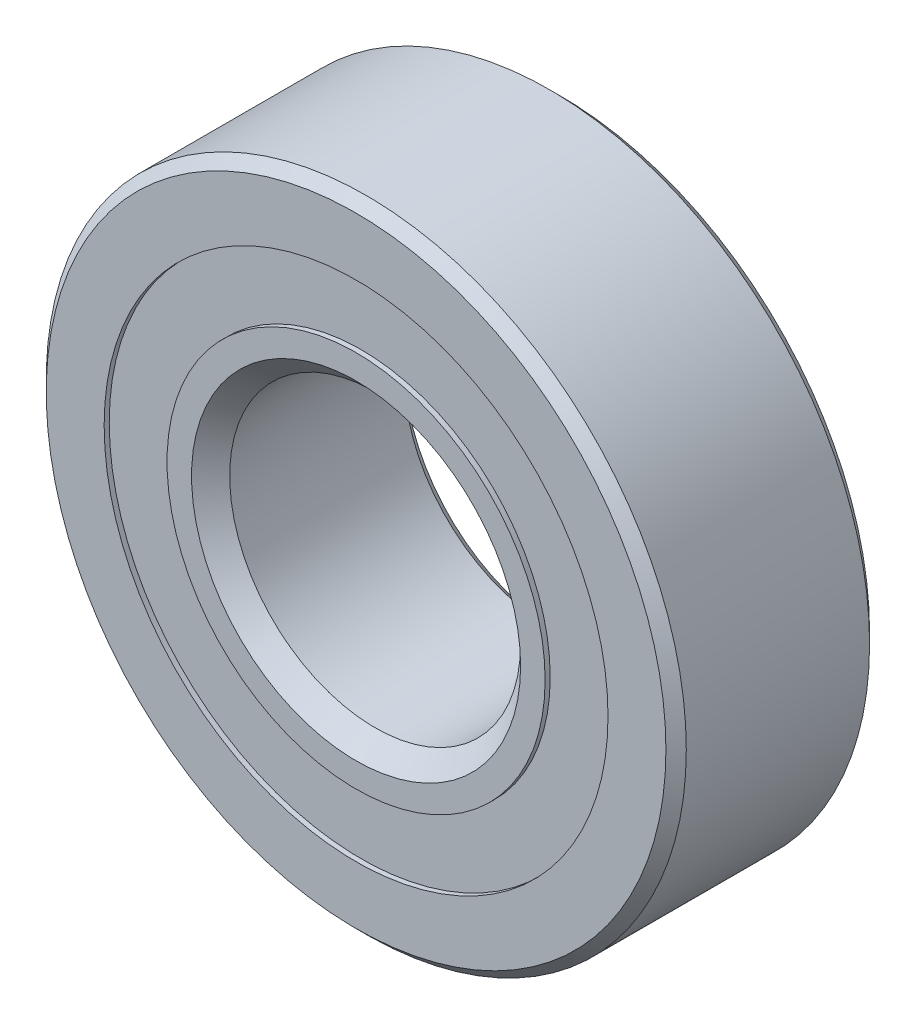
from build123d import *

# Parameters (mm, degrees)
CIRPATTERN1_COUNT = 12
SKETCH5_W         = 2.596321981
SKETCH5_H         = 3.431208825


with BuildPart() as part:
    # Sketch1 → Revolve1 (revolve)
    with BuildSketch(Plane(origin=(0, 0, 0), x_dir=(0, 0, -1), z_dir=(1, 0, 0))):
        with BuildLine():
            Line((5.000625, 17.4625), (-5.000625, 17.4625))
            Line((-5.000625, 17.4625), (-5.55625, 16.906875))
            Line((-5.55625, 16.906875), (-5.55625, 13.746703297))
            Line((-5.55625, 13.746703297), (-2.469444444, 13.746703297))
            ThreePointArc((-2.469444444, 13.746703297), (0, 15.382115519), (2.469444444, 13.746703297))
            Line((2.469444444, 13.746703297), (5.55625, 13.746703297))
            Line((5.55625, 13.746703297), (5.55625, 16.906875))
            Line((5.55625, 16.906875), (5.000625, 17.4625))
        make_face()
    revolve(axis=Axis((0, 0, 5.55625), (0, 0, -1)))


with BuildPart() as body_2:
    # Sketch3 → Revolve3 (revolve)
    with BuildSketch(Plane(origin=(0, 0, 0), x_dir=(0, 0, -1), z_dir=(1, 0, 0))):
        with BuildLine():
            Line((-5.2784375, 10.037681972), (-4.218447769, 8.977692241))
            Line((-4.218447769, 8.977692241), (0, 8.977692241))
            Line((0, 8.977692241), (0, 10.017884481))
            ThreePointArc((0, 10.017884481), (1.480939651, 10.463806492), (2.469444444, 11.653296703))
            Line((2.469444444, 11.653296703), (5.55625, 11.653296703))
            Line((5.55625, 11.653296703), (5.55625, 8.493125))
            Line((5.55625, 8.493125), (5.000625, 7.9375))
            Line((5.000625, 7.9375), (-4.516057759, 7.9375))
            Line((-4.516057759, 7.9375), (-5.55625, 8.977692241))
            Line((-5.55625, 8.977692241), (-5.55625, 10.315494472))
            Line((-5.55625, 10.315494472), (-5.2784375, 10.315494472))
            Line((-5.2784375, 10.315494472), (-5.2784375, 10.037681972))
        make_face()
    revolve(axis=Axis((0, 0, 5.55625), (0, 0, -1)))


with BuildPart() as body_3:
    # Sketch4 → Revolve4 (revolve)
    with BuildSketch(Plane(origin=(0, 0, 0), x_dir=(0, 0, -1), z_dir=(1, 0, 0))):
        with BuildLine():
            Line((-2.682115519, 12.7), (2.682115519, 12.7))
            ThreePointArc((2.682115519, 12.7), (0, 15.382115519), (-2.682115519, 12.7))
        make_face()
    revolve(axis=Axis((0, 12.7, 2.682115519), (0, 0, -1)))


with BuildPart() as cirpattern1_1:
    # CirPattern1: pattern copy
    add(body_3.part.rotate(Axis((0, 0, -5.55625), (0, 0, 1)), 1 * 360 / CIRPATTERN1_COUNT))


with BuildPart() as cirpattern1_2:
    # CirPattern1: pattern copy
    add(body_3.part.rotate(Axis((0, 0, -5.55625), (0, 0, 1)), 2 * 360 / CIRPATTERN1_COUNT))


with BuildPart() as cirpattern1_3:
    # CirPattern1: pattern copy
    add(body_3.part.rotate(Axis((0, 0, -5.55625), (0, 0, 1)), 3 * 360 / CIRPATTERN1_COUNT))


with BuildPart() as cirpattern1_4:
    # CirPattern1: pattern copy
    add(body_3.part.rotate(Axis((0, 0, -5.55625), (0, 0, 1)), 4 * 360 / CIRPATTERN1_COUNT))


with BuildPart() as cirpattern1_5:
    # CirPattern1: pattern copy
    add(body_3.part.rotate(Axis((0, 0, -5.55625), (0, 0, 1)), 5 * 360 / CIRPATTERN1_COUNT))


with BuildPart() as cirpattern1_6:
    # CirPattern1: pattern copy
    add(body_3.part.rotate(Axis((0, 0, -5.55625), (0, 0, 1)), 6 * 360 / CIRPATTERN1_COUNT))


with BuildPart() as cirpattern1_7:
    # CirPattern1: pattern copy
    add(body_3.part.rotate(Axis((0, 0, -5.55625), (0, 0, 1)), 7 * 360 / CIRPATTERN1_COUNT))


with BuildPart() as cirpattern1_8:
    # CirPattern1: pattern copy
    add(body_3.part.rotate(Axis((0, 0, -5.55625), (0, 0, 1)), 8 * 360 / CIRPATTERN1_COUNT))


with BuildPart() as cirpattern1_9:
    # CirPattern1: pattern copy
    add(body_3.part.rotate(Axis((0, 0, -5.55625), (0, 0, 1)), 9 * 360 / CIRPATTERN1_COUNT))


with BuildPart() as cirpattern1_10:
    # CirPattern1: pattern copy
    add(body_3.part.rotate(Axis((0, 0, -5.55625), (0, 0, 1)), 10 * 360 / CIRPATTERN1_COUNT))


with BuildPart() as cirpattern1_11:
    # CirPattern1: pattern copy
    add(body_3.part.rotate(Axis((0, 0, -5.55625), (0, 0, 1)), 11 * 360 / CIRPATTERN1_COUNT))


with BuildPart() as body_15:
    # Sketch5 → Revolve5 (revolve)
    with BuildSketch(Plane(origin=(0, 0, 0), x_dir=(0, 0, -1), z_dir=(1, 0, 0))):
        with Locations((-3.98027651, 12.031098885)):
            Rectangle(SKETCH5_W, SKETCH5_H)
        with Locations((3.98027651, 12.031098885)):
            Rectangle(SKETCH5_W, SKETCH5_H)
    revolve(axis=Axis((0, 0, 5.55625), (0, 0, -1)))


solid = Compound([part.part, body_2.part, body_3.part, cirpattern1_1.part, cirpattern1_2.part, cirpattern1_3.part, cirpattern1_4.part, cirpattern1_5.part, cirpattern1_6.part, cirpattern1_7.part, cirpattern1_8.part, cirpattern1_9.part, cirpattern1_10.part, cirpattern1_11.part, body_15.part])
